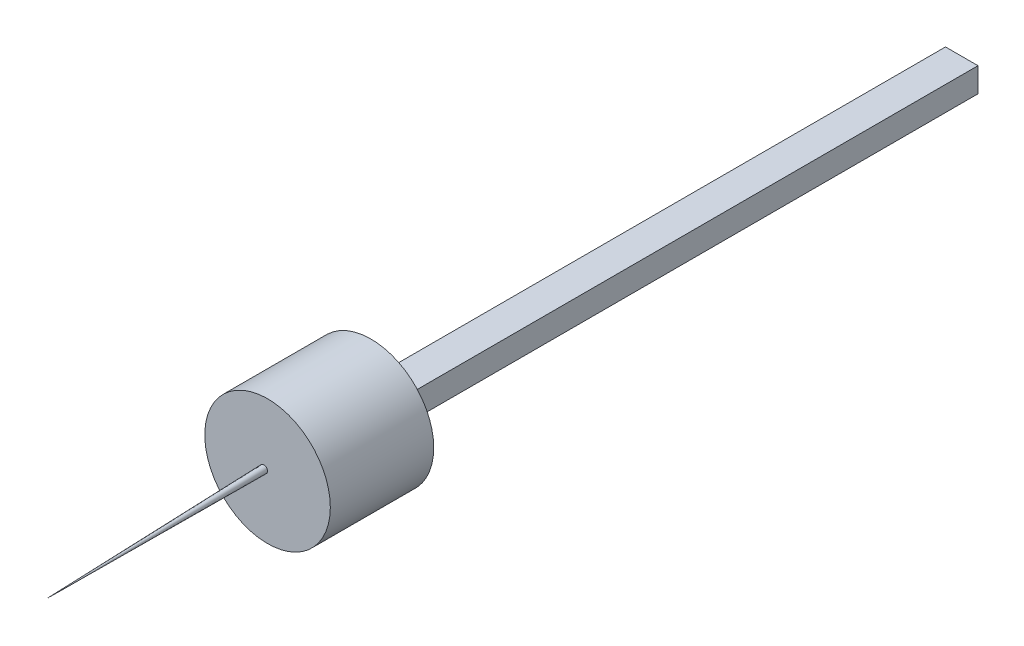
from build123d import *

# Parameters (mm, degrees)
SKETCH1_W           = 4.4
SKETCH1_H           = 3.3
BOSS_EXTRUDE1_DEPTH = 80
SKETCH2_R           = 8.5
BOSS_EXTRUDE2_DEPTH = 14


with BuildPart() as part:
    # Sketch1 → Boss-Extrude1 (new body)
    with BuildSketch(Plane.XY):
        Rectangle(SKETCH1_W, SKETCH1_H)
    extrude(amount=BOSS_EXTRUDE1_DEPTH)

    # Sketch2 → Boss-Extrude2 (add)
    with BuildSketch(Plane.XY.offset(80)):
        Circle(SKETCH2_R)
    extrude(amount=BOSS_EXTRUDE2_DEPTH)


with BuildPart() as body_2:
    # Sketch3 → Revolve1 (revolve)
    with BuildSketch(Plane(origin=(0, 0, 0), x_dir=(1, 0, 0), z_dir=(0, 1, 0))):
        Polygon((0, -94), (0, -124), (-0.5, -94), align=None)
    revolve(axis=Axis((0, 0, 124), (-0.016664352333993458, 0, -0.9998611400396)))


solid = Compound([part.part, body_2.part])
